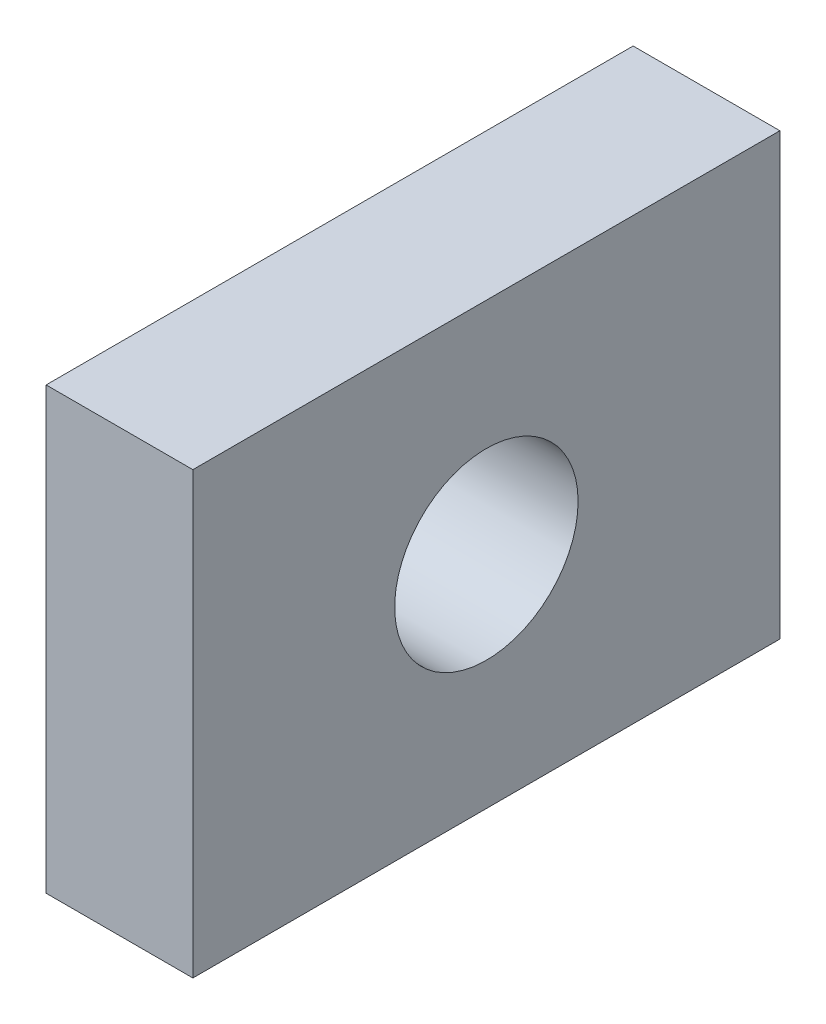
from build123d import *

# Parameters (mm, degrees)
SKETCH1_W           = 101.6
SKETCH1_H           = 76.2
SKETCH1_R           = 15.875
BOSS_EXTRUDE1_DEPTH = 25.4


with BuildPart() as part:
    # Sketch1 → Boss-Extrude1 (new body)
    with BuildSketch(Plane(origin=(0, 0, 0), x_dir=(0, 0, -1), z_dir=(1, 0, 0))):
        Rectangle(SKETCH1_W, SKETCH1_H)
        Circle(SKETCH1_R, mode=Mode.SUBTRACT)
    extrude(amount=BOSS_EXTRUDE1_DEPTH)


solid = part.part
